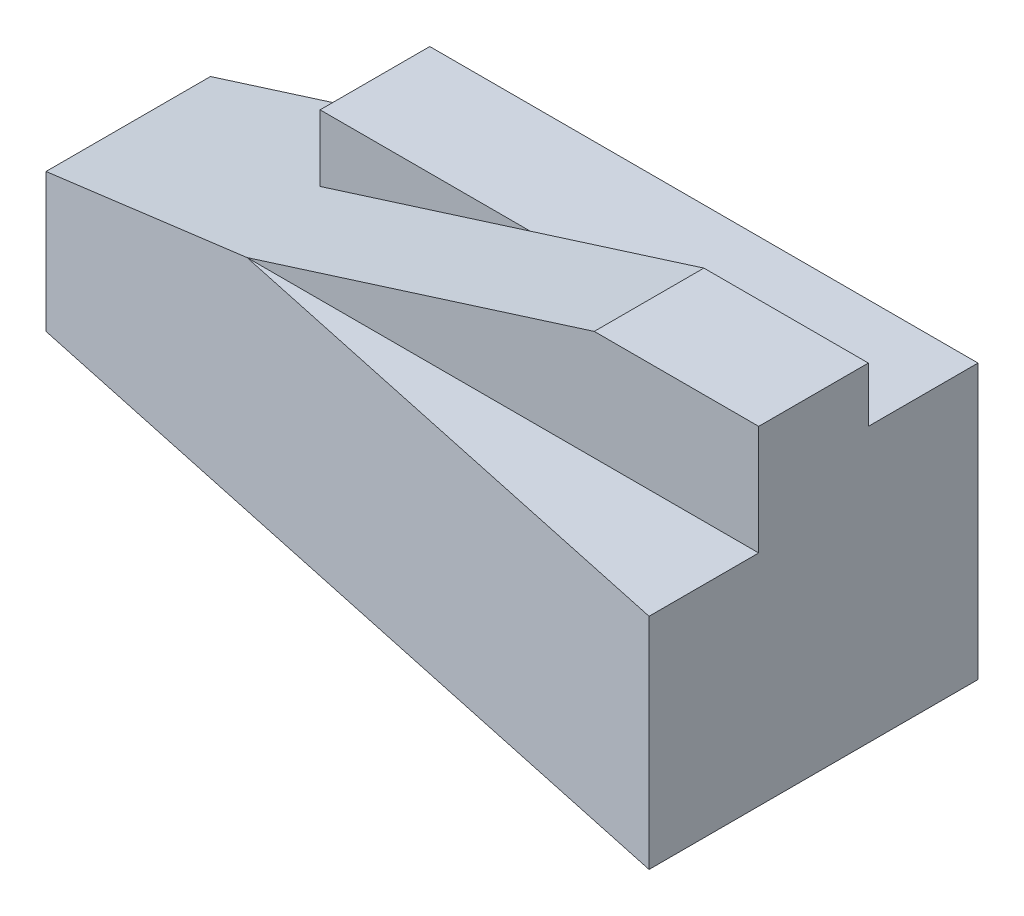
from build123d import *

# Parameters (mm, degrees)
EXTRUDE_1_DEPTH     = 20
SKETCH_2_W          = 15
SKETCH_2_H          = 10
EXTRUDE_2_DEPTH     = 10
SKETCH_3_W          = 50
SKETCH_3_H          = 10
EXTRUDE_3_DEPTH     = 5
EXTRUDE_4_DEPTH     = 10
CUT_EXTRUDE_2_DEPTH = 82.631660278
EXTRUDE_5_DEPTH     = 10


with BuildPart() as part:
    # 草图1 → 凸台-拉伸1 (new body)
    with BuildSketch(Plane(origin=(0, 0, 0), x_dir=(1, 0, 0), z_dir=(0, 1, 0))):
        Polygon((0, 0), (0, -15), (70, -30), (70, 0), align=None)
    extrude(amount=EXTRUDE_1_DEPTH)

    # 草图2 → 凸台-拉伸2 (add)
    with BuildSketch(Plane(origin=(0, 20, 0), x_dir=(1, 0, 0), z_dir=(0, 1, 0))):
        with Locations((62.5, -15)):
            Rectangle(SKETCH_2_W, SKETCH_2_H)
    extrude(amount=EXTRUDE_2_DEPTH)

    # 草图3 → 凸台-拉伸3 (add)
    with BuildSketch(Plane(origin=(0, 20, 0), x_dir=(1, 0, 0), z_dir=(0, 1, 0))):
        with Locations((45, -5)):
            Rectangle(SKETCH_3_W, SKETCH_3_H)
    extrude(amount=EXTRUDE_3_DEPTH)

    # 草图6 → 凸台-拉伸4 (add)
    with BuildSketch(Plane(origin=(0, 0, 20), x_dir=(-1, 0, 0), z_dir=(0, 0, -1))):
        Polygon((-23.333333333, 20), (-55, 30), (-55, 20), align=None)
    extrude(amount=EXTRUDE_4_DEPTH)

    # 草图12 → 切除-拉伸2 (cut, through all)
    with BuildSketch(Plane(origin=(-3.62720403, 11.486146096, 0), x_dir=(0.9535826651341409, 0.30113136793709994, 0), z_dir=(-0.3011313679370999, 0.9535826651341408, 0))):
        Polygon((2.464685971, 0), (2.464685971, -20), (63.372000863, -20), (63.372000863, -10), (25.094280661, -10), (25.094280661, 0), align=None)
    extrude(amount=CUT_EXTRUDE_2_DEPTH, mode=Mode.SUBTRACT)

    # 草图14 → 凸台-拉伸5 (add)
    with BuildSketch(Plane.XY.offset(10)):
        Polygon((20, 20), (20, 18.947368421), (20.304276784, 19.043455826), align=None)
    extrude(amount=-EXTRUDE_5_DEPTH)


solid = part.part
